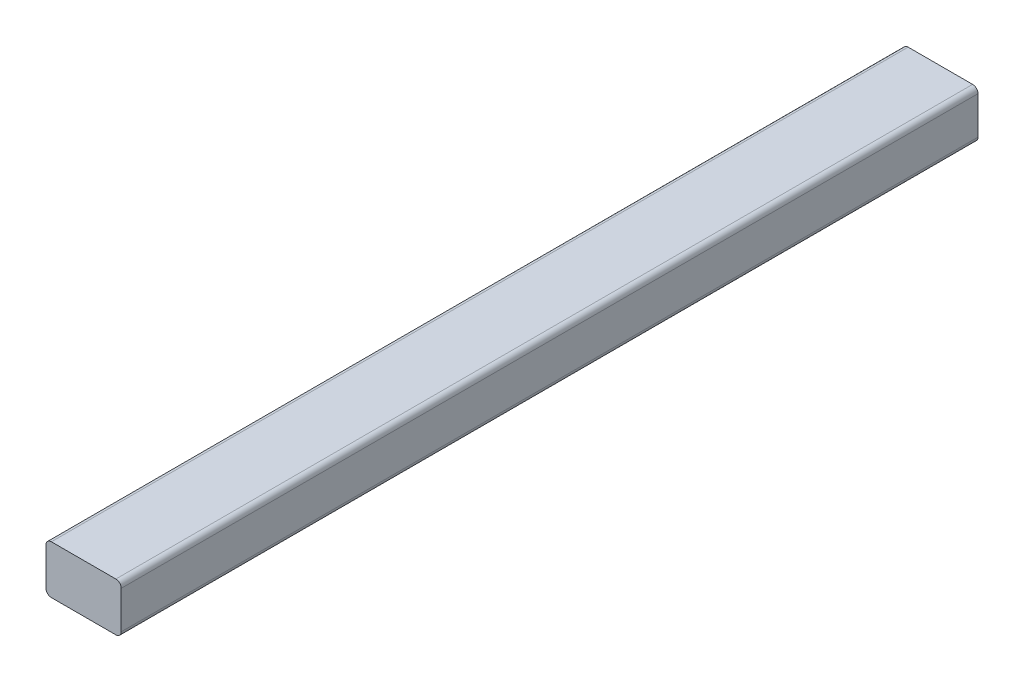
from build123d import *

# Parameters (mm, degrees)
BOSS_EXTRUDE1_DEPTH = 797


with BuildPart() as part:
    # Sketch1 → Boss-Extrude1 (new body)
    with BuildSketch(Plane.XY):
        with BuildLine():
            Line((-37.632109835, 25.565766091), (-37.632109835, -9.434233909))
            ThreePointArc((-37.632109835, -9.434233909), (-36.167643741, -12.969767815), (-32.632109835, -14.434233909))
            Line((-32.632109835, -14.434233909), (27.367890165, -14.434233909))
            ThreePointArc((27.367890165, -14.434233909), (30.903424071, -12.969767815), (32.367890165, -9.434233909))
            Line((32.367890165, -9.434233909), (32.367890165, 25.565766091))
            ThreePointArc((32.367890165, 25.565766091), (30.903424071, 29.101299997), (27.367890165, 30.565766091))
            Line((27.367890165, 30.565766091), (-32.632109835, 30.565766091))
            ThreePointArc((-32.632109835, 30.565766091), (-36.167643741, 29.101299997), (-37.632109835, 25.565766091))
        make_face()
    extrude(amount=BOSS_EXTRUDE1_DEPTH)


solid = part.part
